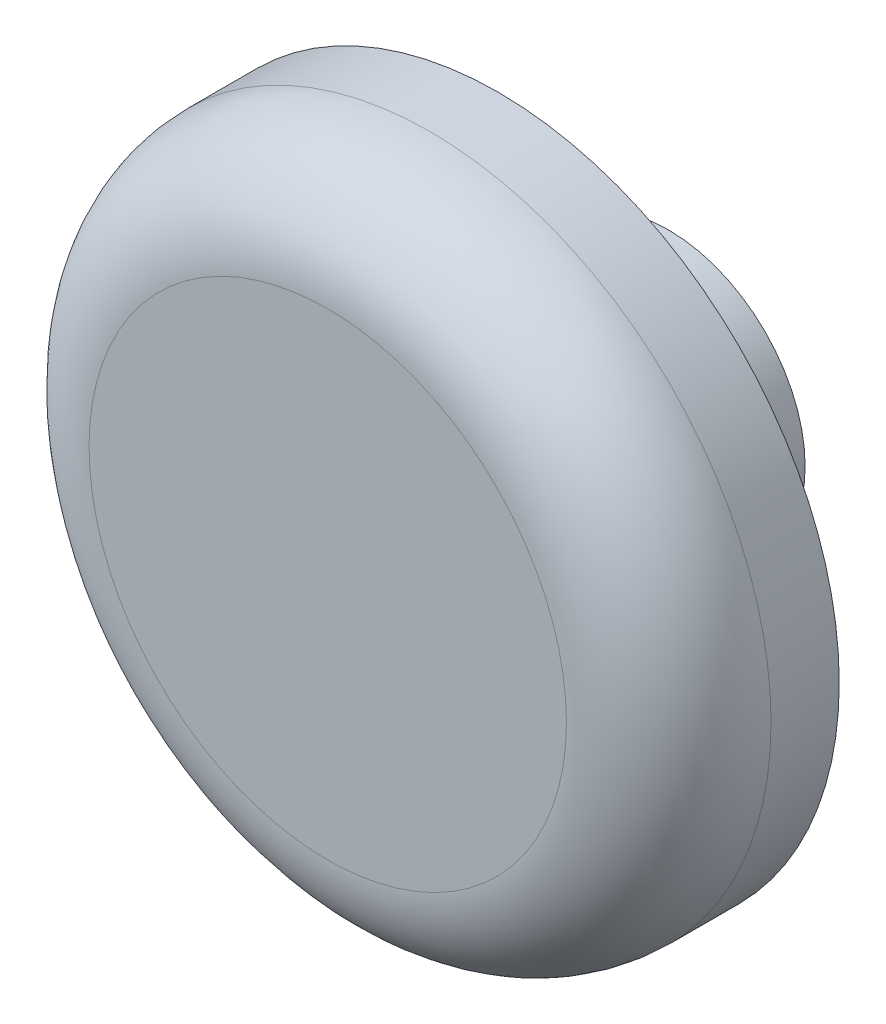
from build123d import *


with BuildPart() as part:
    # Sketch1 → Revolve1 (revolve)
    with BuildSketch(Plane(origin=(0, 0, 0), x_dir=(1, 0, 0), z_dir=(0, 1, 0))):
        with BuildLine():
            Line((4, 0), (0, 0))
            Line((0, 0), (0, -10))
            Line((0, -10), (7, -10))
            ThreePointArc((7, -10), (9.121320344, -9.121320344), (10, -7))
            Line((10, -7), (10, -5))
            Line((10, -5), (4, -5))
            Line((4, -5), (4, 0))
        make_face()
    revolve(axis=Axis((0, 0, 0), (0, 0, 1)))


solid = part.part
